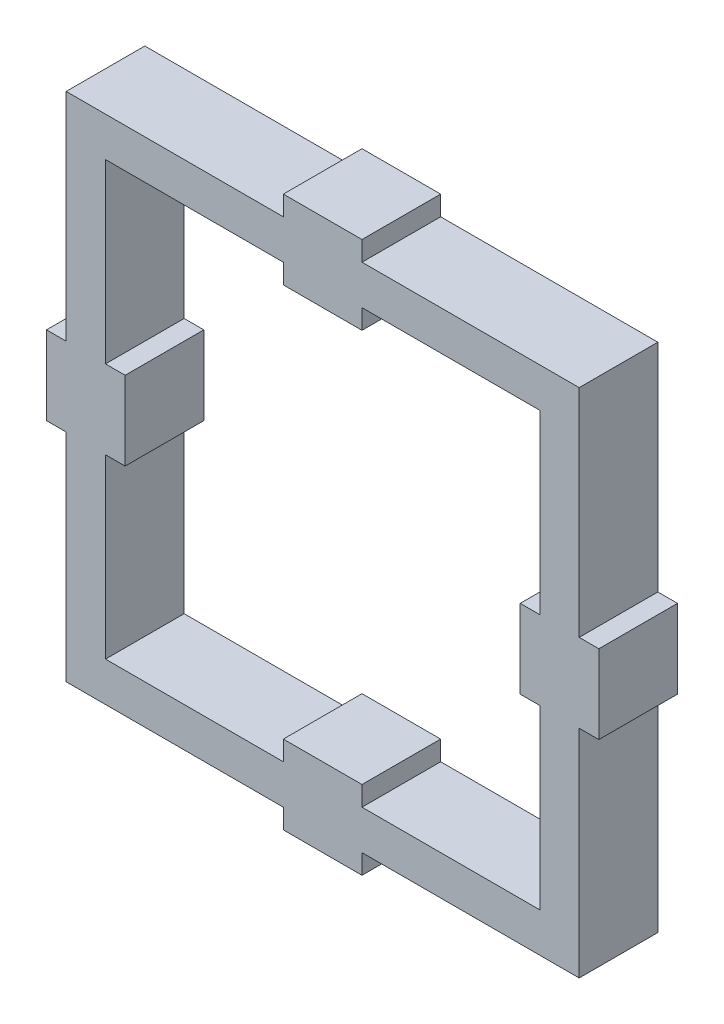
from build123d import *

# Parameters (mm, degrees)
BOSS_EXTRUDE1_DEPTH = 4
SKETCH3_R           = 1
CUT_EXTRUDE1_DEPTH  = 3


with BuildPart() as part:
    # Sketch1 → Boss-Extrude1 (new body)
    with BuildSketch(Plane.XY):
        Polygon((-12.961370769, -0.721570782), (-11.961370769, -0.721570782), (-11.961370769, -11.721570782), (-4.331288589, -11.721570782), (-0.917373368, -11.721570782), (-0.917373368, -12.721570782), (3.082626632, -12.721570782), (3.082626632, -11.721570782), (14.126624033, -11.721570782), (14.126624033, -0.721570782), (15.126624033, -0.721570782), (15.126624033, 3.278429218), (14.126624033, 3.278429218), (14.126624033, 14.278429218), (3.082626632, 14.278429218), (3.082626632, 15.278429218), (-0.917373368, 15.278429218), (-0.917373368, 14.278429218), (-11.961370769, 14.278429218), (-11.961370769, 3.278429218), (-12.961370769, 3.278429218), align=None)
        Polygon((3.082626632, 12.278429218), (12.126624033, 12.278429218), (12.126624033, 3.278429218), (11.126624033, 3.278429218), (11.126624033, -0.721570782), (12.126624033, -0.721570782), (12.126624033, -9.721570782), (3.082626632, -9.721570782), (3.082626632, -8.721570782), (-0.917373368, -8.721570782), (-0.917373368, -9.721570782), (-4.331288589, -9.721570782), (-9.961370769, -9.721570782), (-9.961370769, -0.721570782), (-8.961370769, -0.721570782), (-8.961370769, 3.278429218), (-9.961370769, 3.278429218), (-9.961370769, 12.278429218), (-0.917373368, 12.278429218), (-0.917373368, 11.278429218), (3.082626632, 11.278429218), align=None, mode=Mode.SUBTRACT)
    extrude(amount=BOSS_EXTRUDE1_DEPTH)

    # Sketch3 → Cut-Extrude1 (cut)
    with BuildSketch(Plane.ZY.offset(12.961370769)):
        with Locations(Location((2, 1.278429218, 0), (0, 0, 270))):
            Circle(SKETCH3_R)
    extrude(amount=-CUT_EXTRUDE1_DEPTH, mode=Mode.SUBTRACT)


solid = part.part
